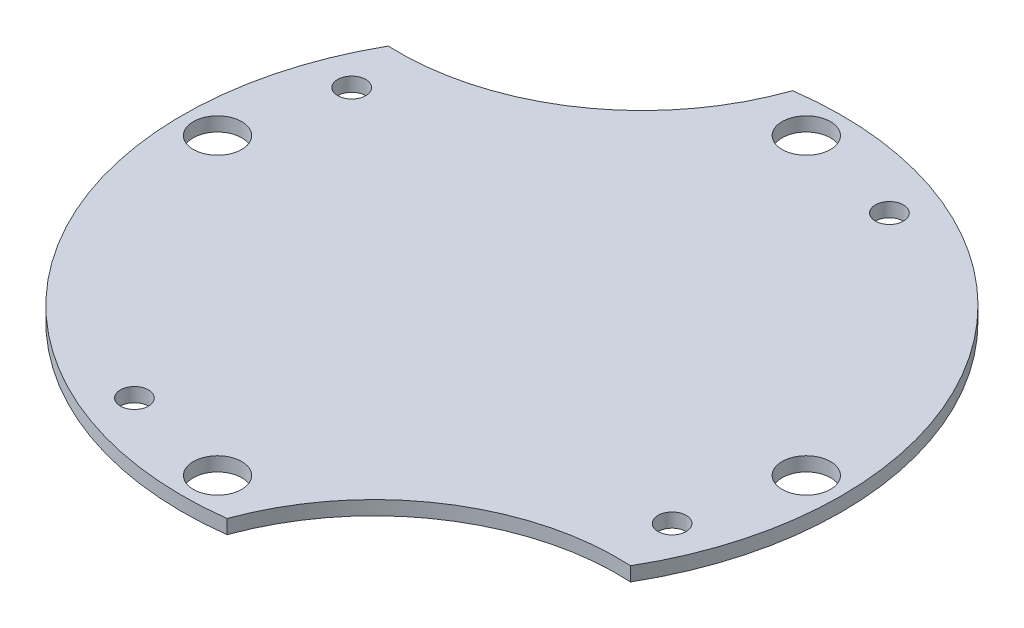
from build123d import *

# Parameters (mm, degrees)
SKETCH1_R           = 37.5
BOSS_EXTRUDE1_DEPTH = 1.6
SKETCH3_R           = 1.6
SKETCH3_R_2         = 2.75
CUT_EXTRUDE1_DEPTH  = 10
SKETCH6_R           = 27.729942467
CUT_EXTRUDE2_DEPTH  = 10


with BuildPart() as part:
    # Sketch1 → Boss-Extrude1 (new body)
    with BuildSketch(Plane(origin=(0, 0, 0), x_dir=(1, 0, 0), z_dir=(0, 1, 0))):
        with Locations(Location((9.035122573, 0.49610085, 0), (0, 0, 270))):
            Circle(SKETCH1_R)
    extrude(amount=BOSS_EXTRUDE1_DEPTH)

    # Sketch3 → Cut-Extrude1 (cut)
    with BuildSketch(Plane(origin=(0, 1.6, 0), x_dir=(1, 0, 0), z_dir=(0, 1, 0))):
        with Locations(Location((-3.32689501, -30.094686593, 0), (0, 0, 270))):
            Circle(SKETCH3_R)
        with Locations(Location((-24.459801803, 0.49610085, 0), (0, 0, 270))):
            Circle(SKETCH3_R_2)
        with Locations(Location((9.035122573, 33.991025226, 0), (0, 0, 270))):
            Circle(SKETCH3_R_2)
        with Locations(Location((42.530046949, 0.49610085, 0), (0, 0, 270))):
            Circle(SKETCH3_R_2)
        with Locations(Location((9.035122573, -32.998823526, 0), (0, 0, 270))):
            Circle(SKETCH3_R_2)
        with Locations(Location((-21.55566487, 12.858118433, 0), (0, 0, 270))):
            Circle(SKETCH3_R)
        with Locations(Location((21.397140156, 31.086888293, 0), (0, 0, 270))):
            Circle(SKETCH3_R)
        with Locations(Location((39.625910016, -11.865916733, 0), (0, 0, 270))):
            Circle(SKETCH3_R)
    extrude(amount=-CUT_EXTRUDE1_DEPTH, mode=Mode.SUBTRACT)

    # Sketch6 → Cut-Extrude2 (cut)
    with BuildSketch(Plane(origin=(0, 1.6, 0), x_dir=(1, 0, 0), z_dir=(0, 1, 0))):
        with Locations((39.912604148, -46.085156826)):
            Circle(SKETCH6_R)
        with Locations((-22.36020617, 46.729917134)):
            Circle(SKETCH6_R)
    extrude(amount=-CUT_EXTRUDE2_DEPTH, mode=Mode.SUBTRACT)


solid = part.part
